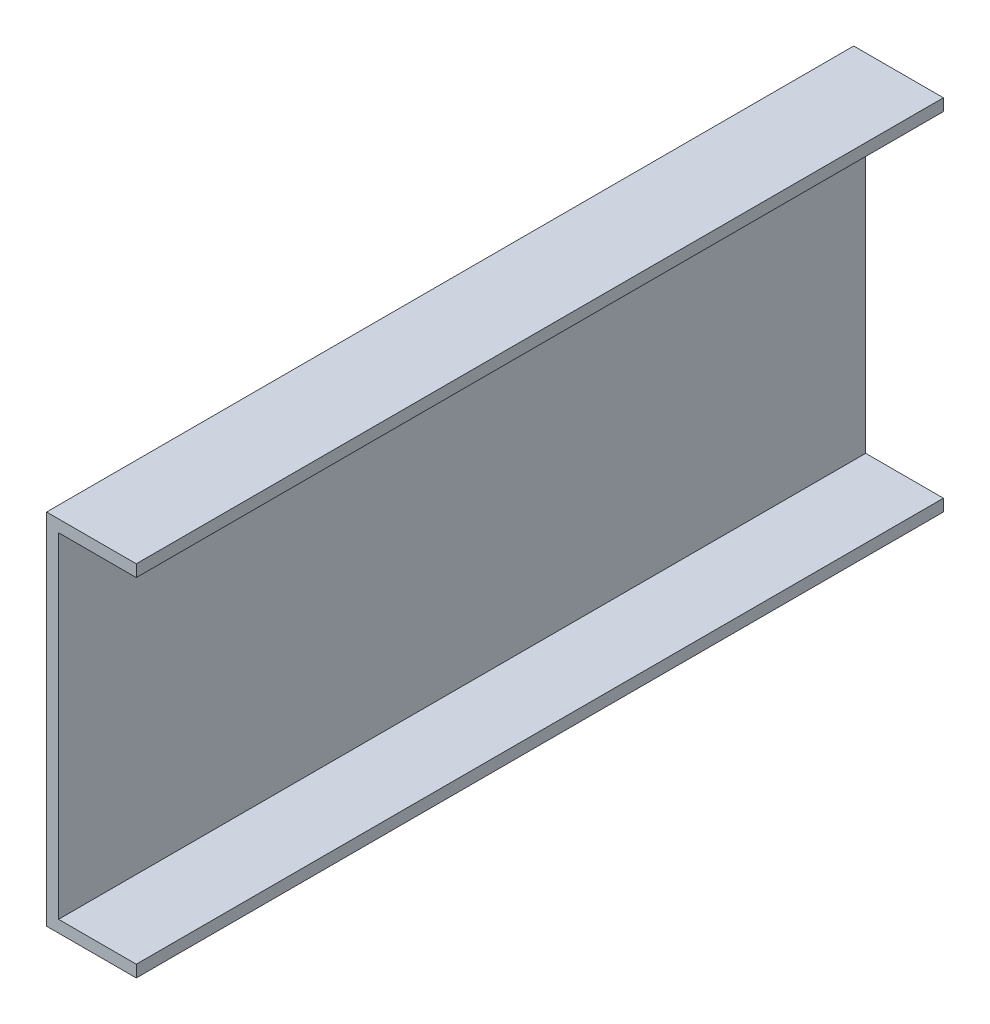
from build123d import *

# Parameters (mm, degrees)
EXTRUDE_THIN1_DEPTH = 171.45


with BuildPart() as part:
    # Sketch1 → Extrude-Thin1 (new body)
    with BuildSketch(Plane.XY):
        Polygon((-55.28006135, 44.644785276), (-74.33006135, 44.644785276), (-74.33006135, -31.555214724), (-55.28006135, -31.555214724), (-55.28006135, -29.015214724), (-71.79006135, -29.015214724), (-71.79006135, 42.104785276), (-55.28006135, 42.104785276), align=None)
    extrude(amount=EXTRUDE_THIN1_DEPTH)


solid = part.part
